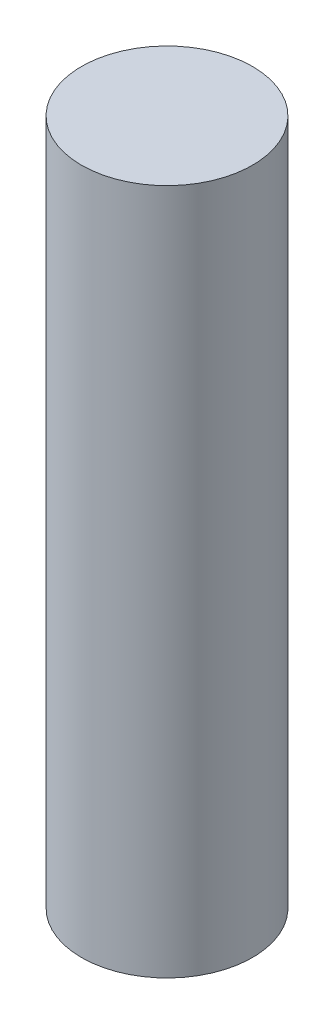
from build123d import *

# Parameters (mm, degrees)
SKETCH1_R           = 0.0935
BOSS_EXTRUDE1_DEPTH = 0.75


with BuildPart() as part:
    # Sketch1 → Boss-Extrude1 (new body)
    with BuildSketch(Plane(origin=(0, 0, 0), x_dir=(1, 0, 0), z_dir=(0, 1, 0))):
        with Locations(Location((0, 0, 0), (0, 0, 270))):
            Circle(SKETCH1_R)
    extrude(amount=BOSS_EXTRUDE1_DEPTH)


solid = part.part
